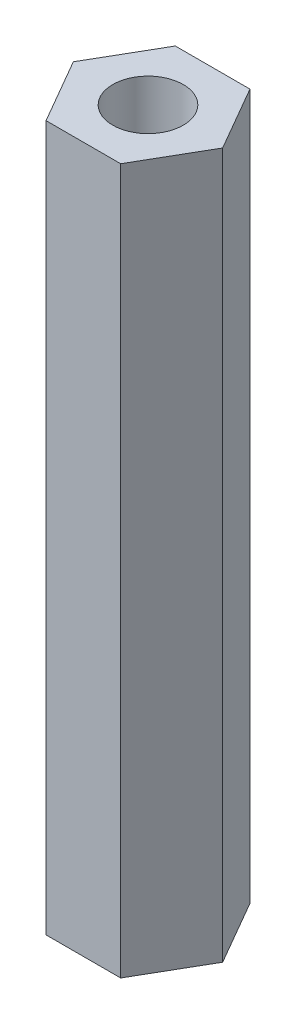
from build123d import *

# Parameters (mm, degrees)
SKETCH_1_R      = 1.5
EXTRUDE_1_DEPTH = 30


with BuildPart() as part:
    # 草图1 → 凸台-拉伸1 (new body)
    with BuildSketch(Plane(origin=(0, 0, 0), x_dir=(1, 0, 0), z_dir=(0, 1, 0))):
        Polygon((3.175426481, 0), (1.58771324, 2.75), (-1.58771324, 2.75), (-3.175426481, 0), (-1.58771324, -2.75), (1.58771324, -2.75), align=None)
        with Locations(Location((0, 0, 0), (0, 0, 270))):
            Circle(SKETCH_1_R, mode=Mode.SUBTRACT)
    extrude(amount=EXTRUDE_1_DEPTH)


solid = part.part
